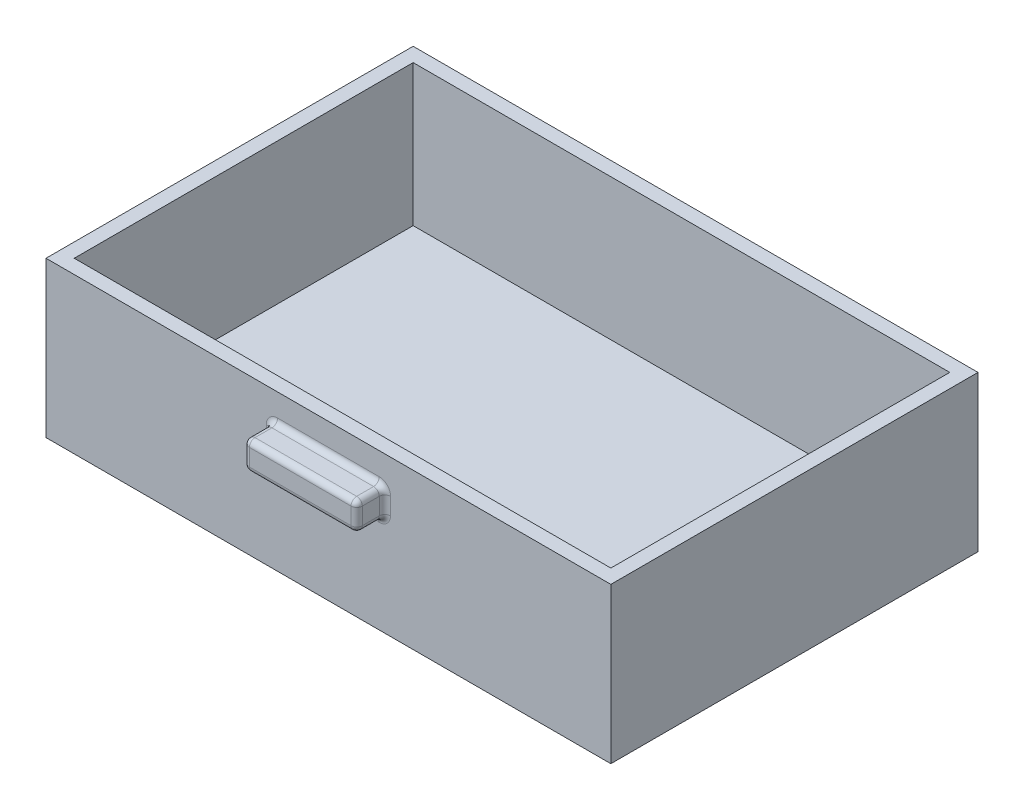
from build123d import *

# Parameters (mm, degrees)
SKETCH2_W           = 254
SKETCH2_H           = 165.1
BOSS_EXTRUDE1_DEPTH = 6.35
SKETCH3_W           = 254
SKETCH3_H           = 165.1
SKETCH3_W_2         = 241.3
SKETCH3_H_2         = 152.4
BOSS_EXTRUDE2_DEPTH = 63.5
SKETCH4_W           = 50.8
SKETCH4_H           = 12.7
BOSS_EXTRUDE3_DEPTH = 12.7
SKETCH6_W           = 44.45
SKETCH6_H           = 8.276182153
CUT_EXTRUDE1_DEPTH  = 8.89
FILLET1_R           = 2.54


with BuildPart() as part:
    # Sketch2 → Boss-Extrude1 (new body)
    with BuildSketch(Plane(origin=(0, 0, 0), x_dir=(1, 0, 0), z_dir=(0, 1, 0))):
        Rectangle(SKETCH2_W, SKETCH2_H)
    extrude(amount=BOSS_EXTRUDE1_DEPTH)

    # Sketch3 → Boss-Extrude2 (add)
    with BuildSketch(Plane(origin=(0, 6.35, 0), x_dir=(1, 0, 0), z_dir=(0, 1, 0))):
        Rectangle(SKETCH3_W, SKETCH3_H)
        Rectangle(SKETCH3_W_2, SKETCH3_H_2, mode=Mode.SUBTRACT)
    extrude(amount=BOSS_EXTRUDE2_DEPTH)

    # Sketch4 → Boss-Extrude3 (add)
    with BuildSketch(Plane.XY.offset(82.55)):
        with Locations((0, 50.8)):
            Rectangle(SKETCH4_W, SKETCH4_H)
    extrude(amount=BOSS_EXTRUDE3_DEPTH)

    # Sketch6 → Cut-Extrude1 (cut)
    with BuildSketch(Plane(origin=(0, 44.45, 0), x_dir=(-1, 0, 0), z_dir=(0, -1, 0))):
        with Locations((0, -86.688091077)):
            Rectangle(SKETCH6_W, SKETCH6_H)
    extrude(amount=-CUT_EXTRUDE1_DEPTH, mode=Mode.SUBTRACT)

    # Fillet1
    fillet1_edges = [part.edges().sort_by_distance(p)[0] for p in [
        (-25.4, 50.8, 82.55),
        (-25.4, 57.15, 88.9),
        (-23.8125, 44.45, 82.55),
        (-25.4, 44.45, 88.9),
        (25.4, 50.8, 82.55),
        (25.4, 44.45, 88.9),
        (0, 57.15, 82.55),
        (25.4, 57.15, 88.9),
        (-25.4, 50.8, 95.25),
        (0, 44.45, 95.25),
        (25.4, 50.8, 95.25),
        (0, 57.15, 95.25),
        (23.8125, 44.45, 82.55),
    ]]
    fillet(fillet1_edges, radius=FILLET1_R)


solid = part.part
